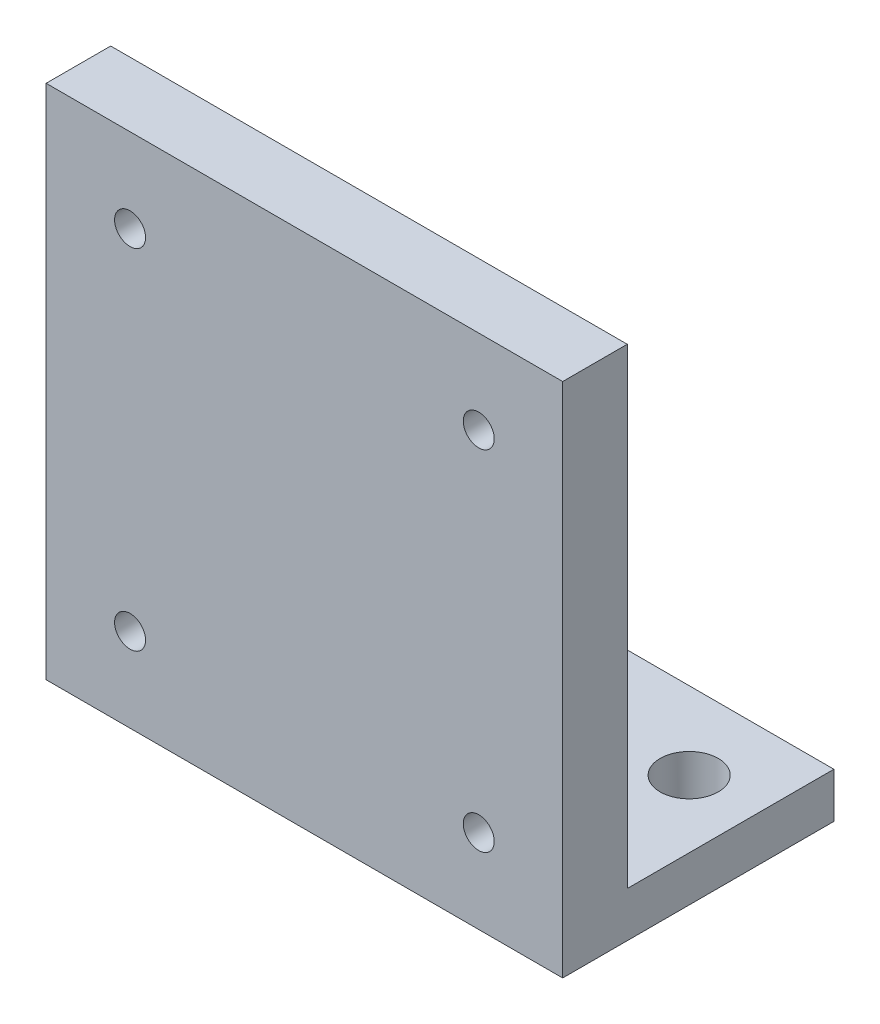
from build123d import *

# Parameters (mm, degrees)
SKETCH_1_W          = 40
SKETCH_1_H          = 40
EXTRUDE_1_DEPTH     = 5
SKETCH_2_W          = 40
SKETCH_2_H          = 5
EXTRUDE_2_DEPTH     = 35
SKETCH_3_W          = 40
SKETCH_3_H          = 10
EXTRUDE_3_DEPTH     = 5
EXTRUDE_4_DEPTH     = 5
SKETCH_5_R          = 2.25
CUT_EXTRUDE_1_DEPTH = 20
CUT_EXTRUDE_2_DEPTH = 40
SKETCH_7_W          = 40
SKETCH_7_H          = 19
CUT_EXTRUDE_3_DEPTH = 20
SKETCH_8_W          = 40
SKETCH_8_H          = 1.5
CUT_EXTRUDE_4_DEPTH = 16
SKETCH_9_R          = 1.2
CUT_EXTRUDE_5_DEPTH = 20


with BuildPart() as part:
    # 草图1 → 凸台-拉伸1 (new body)
    with BuildSketch(Plane(origin=(0, 0, 0), x_dir=(1, 0, 0), z_dir=(0, 1, 0))):
        Rectangle(SKETCH_1_W, SKETCH_1_H)
    extrude(amount=EXTRUDE_1_DEPTH)

    # 草图2 → 凸台-拉伸2 (add)
    with BuildSketch(Plane(origin=(0, 5, 0), x_dir=(1, 0, 0), z_dir=(0, 1, 0))):
        with Locations((0, 1.5)):
            Rectangle(SKETCH_2_W, SKETCH_2_H)
    extrude(amount=EXTRUDE_2_DEPTH)

    # 草图3 → 凸台-拉伸3 (add)
    with BuildSketch(Plane.XZ):
        with Locations((0, 15)):
            Rectangle(SKETCH_3_W, SKETCH_3_H)
    extrude(amount=EXTRUDE_3_DEPTH)

    # 草图4 → 凸台-拉伸4 (add)
    with BuildSketch(Plane.XZ.offset(5)):
        Polygon((-20, 10), (-20, -20), (20, -20), (20, 10), (20, 20), (-20, 20), align=None)
    extrude(amount=EXTRUDE_4_DEPTH)

    # 草图5 → 切除-拉伸1 (cut)
    with BuildSketch(Plane(origin=(0, 5, 0), x_dir=(1, 0, 0), z_dir=(0, 1, 0))):
        with Locations(Location((-14.795139738, 14, 0), (0, 0, 90))):
            Circle(SKETCH_5_R)
        with Locations(Location((14.795139738, 14, 0), (0, 0, 90))):
            Circle(SKETCH_5_R)
    extrude(amount=-CUT_EXTRUDE_1_DEPTH, mode=Mode.SUBTRACT)

    # 草图6 → 切除-拉伸2 (cut)
    with BuildSketch(Plane.ZY.offset(20)):
        Polygon((10, 0), (20, 0), (20, -10), (-20, -10), (-20, -5), (10, -5), align=None)
    extrude(amount=-CUT_EXTRUDE_2_DEPTH, mode=Mode.SUBTRACT)

    # 草图7 → 切除-拉伸3 (cut)
    with BuildSketch(Plane(origin=(0, 5, 0), x_dir=(1, 0, 0), z_dir=(0, 1, 0))):
        with Locations((0, -10.5)):
            Rectangle(SKETCH_7_W, SKETCH_7_H)
    extrude(amount=-CUT_EXTRUDE_3_DEPTH, mode=Mode.SUBTRACT)

    # 草图8 → 切除-拉伸4 (cut)
    with BuildSketch(Plane(origin=(0, 0, -20), x_dir=(-1, 0, 0), z_dir=(0, 0, -1))):
        with Locations((0, 4.25)):
            Rectangle(SKETCH_8_W, SKETCH_8_H)
    extrude(amount=-CUT_EXTRUDE_4_DEPTH, mode=Mode.SUBTRACT)

    # 草图9 → 切除-拉伸5 (cut)
    with BuildSketch(Plane.XY.offset(1)):
        with Locations((13.5, 6.5)):
            Circle(SKETCH_9_R)
        with Locations((-13.5, 6.5)):
            Circle(SKETCH_9_R)
        with Locations((-13.5, 33.5)):
            Circle(SKETCH_9_R)
        with Locations((13.5, 33.5)):
            Circle(SKETCH_9_R)
    extrude(amount=-CUT_EXTRUDE_5_DEPTH, mode=Mode.SUBTRACT)


solid = part.part
